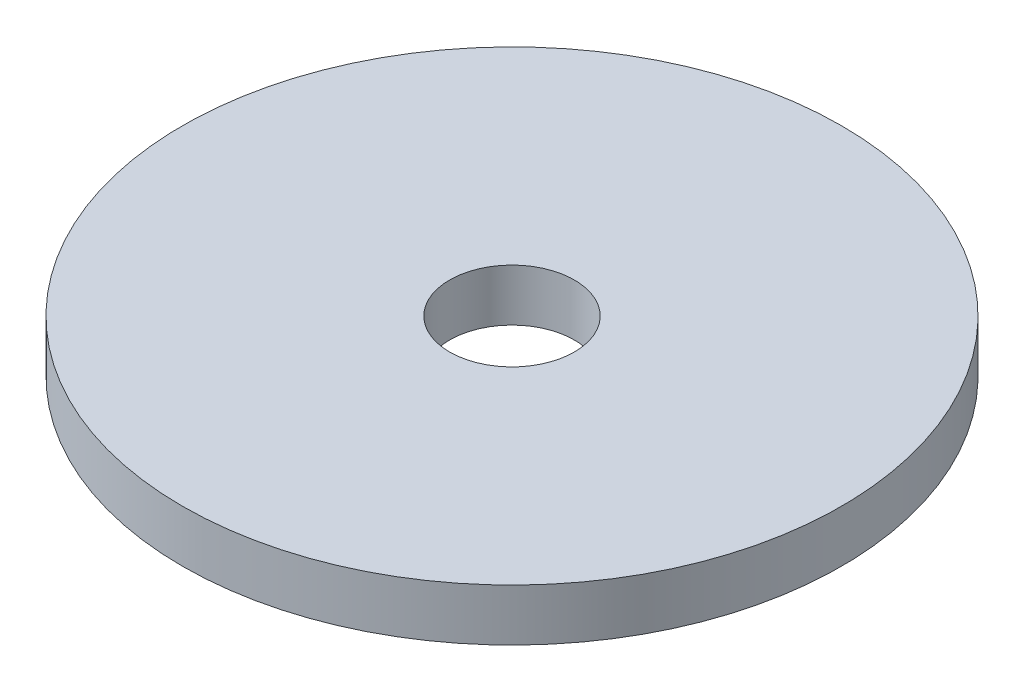
from build123d import *

# Parameters (mm, degrees)
SKETCH1_R           = 15.845
SKETCH1_R_2         = 3
BOSS_EXTRUDE1_DEPTH = 2.5


with BuildPart() as part:
    # Sketch1 → Boss-Extrude1 (new body)
    with BuildSketch(Plane(origin=(0, 0, 0), x_dir=(1, 0, 0), z_dir=(0, 1, 0))):
        with Locations(Location((0, 0, 0), (0, 0, 270))):
            Circle(SKETCH1_R)
        with Locations(Location((0, 0, 0), (0, 0, 270))):
            Circle(SKETCH1_R_2, mode=Mode.SUBTRACT)
    extrude(amount=BOSS_EXTRUDE1_DEPTH)


solid = part.part
